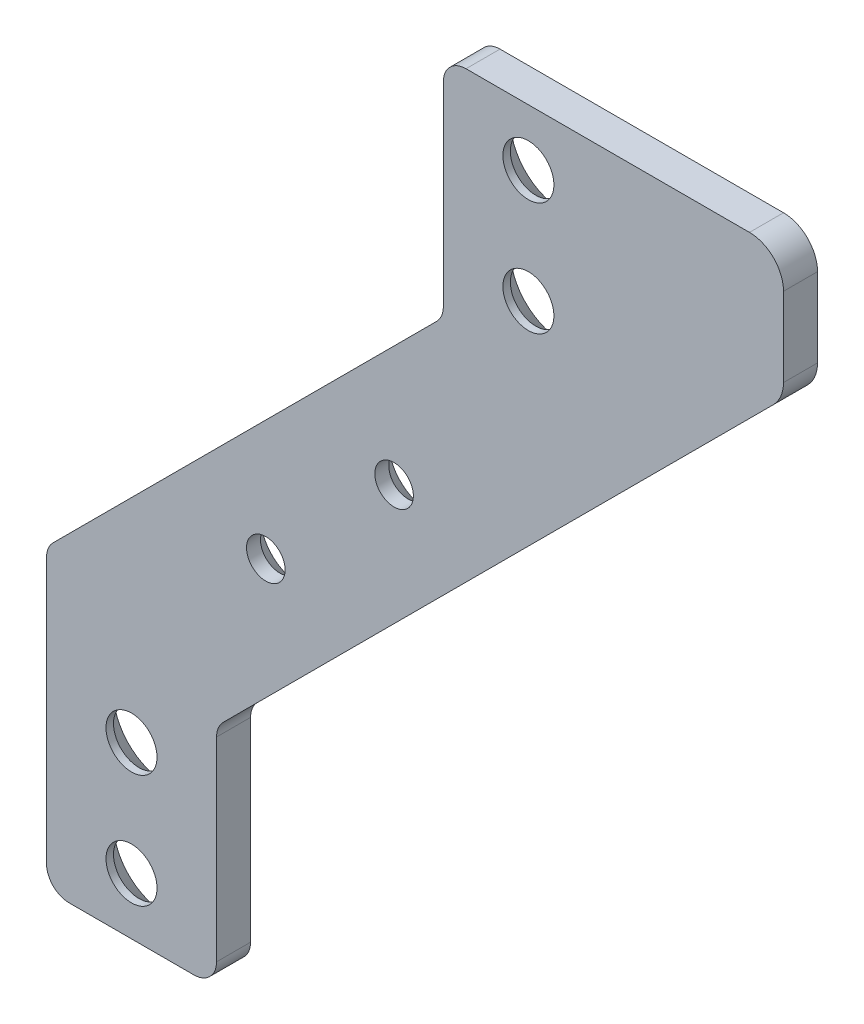
from build123d import *

# Parameters (mm, degrees)
EXTRUDE_1_DEPTH              = 3
FILLET_1_R                   = 2
HOLE_WIZARD_M4_1_D           = 4.5
HOLE_WIZARD_M4_1_DEPTH       = 24.5
HOLE_WIZARD_M4_1_CSINK_D     = 9.18
HOLE_WIZARD_M4_1_CSINK_ANGLE = 90
HOLE_WIZARD_M4_1_TIP         = 1.351936393
HOLE_WIZARD_M3_1_D           = 3.4
HOLE_WIZARD_M3_1_DEPTH       = 24.5
HOLE_WIZARD_M3_1_CSINK_D     = 6.94
HOLE_WIZARD_M3_1_CSINK_ANGLE = 90
HOLE_WIZARD_M3_1_TIP         = 1.021463052
EXTRUDE_START                = -3
EXTRUDE_2_DEPTH              = 3
FILLET_2_R                   = 3


with BuildPart() as part:
    # 草图1 → 凸台-拉伸1 (new body)
    with BuildSketch(Plane.XY):
        Polygon((0, 0), (-15, 0), (-15, 26.213203436), (20, 61.213203436), (20, 81.213203436), (35, 81.213203436), (35, 55), (0, 20), align=None)
    extrude(amount=EXTRUDE_1_DEPTH)

    # 圆角1
    fillet_1_edges = [part.edges().sort_by_distance(p)[0] for p in [
        (0, 0, 1.5),
        (-15, 0, 1.5),
        (-15, 26.213203436, 1.5),
        (20, 61.213203436, 1.5),
        (20, 81.213203436, 1.5),
        (35, 81.213203436, 1.5),
        (35, 55, 1.5),
        (0, 20, 1.5),
    ]]
    fillet(fillet_1_edges, radius=FILLET_1_R)

    # M4 六角凹锥坑头螺钉的锥形沉头孔1
    with Locations(Plane(origin=(27.5, 76.213203436, 0), x_dir=(-1, 0, 0), z_dir=(0, 0, -1))):
        with Locations((0, 0), (0, -10), (35, -61.213203436), (35, -71.213203436)):
            CounterSinkHole(HOLE_WIZARD_M4_1_D / 2, HOLE_WIZARD_M4_1_CSINK_D / 2, depth=HOLE_WIZARD_M4_1_DEPTH, counter_sink_angle=HOLE_WIZARD_M4_1_CSINK_ANGLE)
            with Locations((0, 0, -(HOLE_WIZARD_M4_1_DEPTH + HOLE_WIZARD_M4_1_TIP / 2))):  # 118° drill point
                Cone(0, HOLE_WIZARD_M4_1_D / 2, HOLE_WIZARD_M4_1_TIP, mode=Mode.SUBTRACT)

    # M3 六角凹锥坑头螺钉的锥形沉头孔1
    with Locations(Plane(origin=(15.656854249, 46.263455967, 0), x_dir=(-1, 0, 0), z_dir=(0, 0, -1))):
        with Locations((0, 0), (11.313708498, -11.313708499)):
            CounterSinkHole(HOLE_WIZARD_M3_1_D / 2, HOLE_WIZARD_M3_1_CSINK_D / 2, depth=HOLE_WIZARD_M3_1_DEPTH, counter_sink_angle=HOLE_WIZARD_M3_1_CSINK_ANGLE)
            with Locations((0, 0, -(HOLE_WIZARD_M3_1_DEPTH + HOLE_WIZARD_M3_1_TIP / 2))):  # 118° drill point
                Cone(0, HOLE_WIZARD_M3_1_D / 2, HOLE_WIZARD_M3_1_TIP, mode=Mode.SUBTRACT)

    # 草图5 → 凸台-拉伸2 (add)
    with BuildSketch(Plane(origin=(0, 0, 0), x_dir=(-1, 0, 0), z_dir=(0, 0, -1)).offset(EXTRUDE_START)):
        with BuildLine():
            Line((-33, 81.213203436), (-50, 81.213203436))
            Line((-50, 81.213203436), (-50, 70))
            Line((-50, 70), (-34.414213562, 54.414213562))
            ThreePointArc((-34.414213562, 54.414213562), (-34.847759065, 55.06306026), (-35, 55.828427125))
            Line((-35, 55.828427125), (-35, 79.213203436))
            ThreePointArc((-35, 79.213203436), (-34.414213562, 80.627416998), (-33, 81.213203436))
        make_face()
    extrude(amount=EXTRUDE_2_DEPTH)

    # 圆角2
    fillet_2_edges = [part.edges().sort_by_distance(p)[0] for p in [
        (50, 70, 1.5),
        (50, 81.213203436, 1.5),
    ]]
    fillet(fillet_2_edges, radius=FILLET_2_R)


solid = part.part
